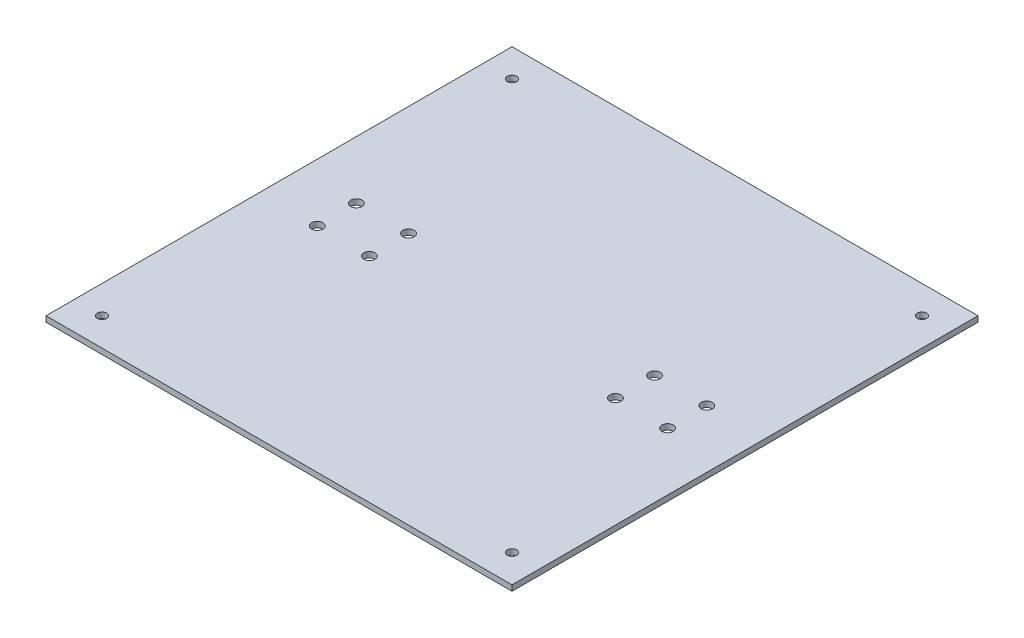
from build123d import *

# Parameters (mm, degrees)
SKETCH1_W           = 250
SKETCH1_H           = 250
BOSS_EXTRUDE1_DEPTH = 3
SKETCH2_R           = 2.5
SKETCH2_R_2         = 3
CUT_EXTRUDE1_DEPTH  = 354.566118286


with BuildPart() as part:
    # Sketch1 → Boss-Extrude1 (new body)
    with BuildSketch(Plane(origin=(0, 0, 0), x_dir=(1, 0, 0), z_dir=(0, 1, 0))):
        with Locations((125, 125)):
            Rectangle(SKETCH1_W, SKETCH1_H)
    extrude(amount=BOSS_EXTRUDE1_DEPTH)

    # Sketch2 → Cut-Extrude1 (cut, through all)
    with BuildSketch(Plane(origin=(0, 3, 0), x_dir=(1, 0, 0), z_dir=(0, 1, 0))):
        with Locations(Location((15, 235, 0), (0, 0, 270))):
            Circle(SKETCH2_R)
        with Locations(Location((235, 235, 0), (0, 0, 270))):
            Circle(SKETCH2_R)
        with Locations(Location((235, 15, 0), (0, 0, 270))):
            Circle(SKETCH2_R)
        with Locations(Location((15, 15, 0), (0, 0, 270))):
            Circle(SKETCH2_R)
        with Locations(Location((31, 135.5, 0), (0, 0, 270))):
            Circle(SKETCH2_R_2)
        with Locations(Location((59, 135.5, 0), (0, 0, 270))):
            Circle(SKETCH2_R_2)
        with Locations(Location((59, 114.5, 0), (0, 0, 270))):
            Circle(SKETCH2_R_2)
        with Locations(Location((31, 114.5, 0), (0, 0, 270))):
            Circle(SKETCH2_R_2)
        with Locations(Location((191, 135.5, 0), (0, 0, 270))):
            Circle(SKETCH2_R_2)
        with Locations(Location((219, 135.5, 0), (0, 0, 270))):
            Circle(SKETCH2_R_2)
        with Locations(Location((219, 114.5, 0), (0, 0, 270))):
            Circle(SKETCH2_R_2)
        with Locations(Location((191, 114.5, 0), (0, 0, 270))):
            Circle(SKETCH2_R_2)
    extrude(amount=-CUT_EXTRUDE1_DEPTH, mode=Mode.SUBTRACT)


solid = part.part
